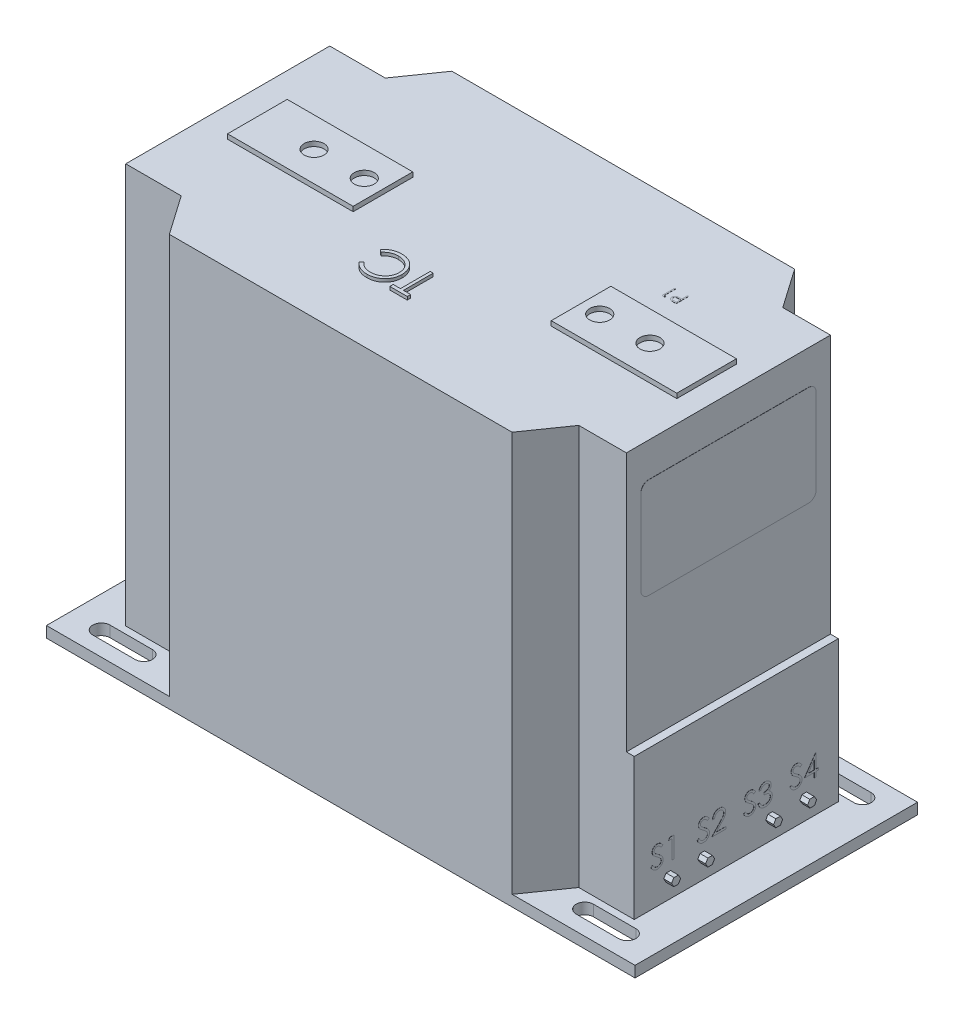
from build123d import *

# Parameters (mm, degrees)
CROQUIS1_W              = 375
CROQUIS1_H              = 180
SALIENTE_EXTRUIR1_DEPTH = 262
CROQUIS2_W              = 80
CROQUIS2_H              = 38
CROQUIS2_R              = 6.35
SALIENTE_EXTRUIR2_DEPTH = 3
CORTAR_EXTRUIR1_DEPTH   = 255
CORTAR_EXTRUIR2_DEPTH   = 277
CROQUIS5_W              = 130
CROQUIS5_H              = 165
CORTAR_EXTRUIR3_DEPTH   = 5
SALIENTE_EXTRUIR3_DEPTH = 5
SALIENTE_EXTRUIR4_DEPTH = 0.1
SALIENTE_EXTRUIR5_DEPTH = 0.1
CROQUIS9_R              = 4.75
SALIENTE_EXTRUIR6_DEPTH = 5
SALIENTE_EXTRUIR7_DEPTH = 0.1
SALIENTE_EXTRUIR8_DEPTH = 2


with BuildPart() as part:
    # Croquis1 → Saliente-Extruir1 (new body)
    with BuildSketch(Plane(origin=(0, 0, 0), x_dir=(1, 0, 0), z_dir=(0, 1, 0))):
        Rectangle(CROQUIS1_W, CROQUIS1_H)
    extrude(amount=SALIENTE_EXTRUIR1_DEPTH)

    # Croquis2 → Saliente-Extruir2 (add)
    # profile 1 of 2: a face of its own
    with BuildSketch(Plane(origin=(0, 262, 0), x_dir=(1, 0, 0), z_dir=(0, 1, 0))):
        with Locations((103.107795334, 0)):
            Rectangle(CROQUIS2_W, CROQUIS2_H)
        with Locations(Location((75, 0, 0), (0, 0, 270))):
            Circle(CROQUIS2_R, mode=Mode.SUBTRACT)
        with Locations(Location((107, 0, 0), (0, 0, 270))):
            Circle(CROQUIS2_R, mode=Mode.SUBTRACT)
    # profile 2 of 2: a face of its own
    with BuildSketch(Plane(origin=(0, 262, 0), x_dir=(1, 0, 0), z_dir=(0, 1, 0))):
        with Locations((-103.107795334, 0)):
            Rectangle(CROQUIS2_W, CROQUIS2_H)
        with Locations(Location((-107, 0, 0), (0, 0, 90))):
            Circle(CROQUIS2_R, mode=Mode.SUBTRACT)
        with Locations(Location((-75, 0, 0), (0, 0, 90))):
            Circle(CROQUIS2_R, mode=Mode.SUBTRACT)
    extrude(amount=SALIENTE_EXTRUIR2_DEPTH)

    # Croquis3 → Cortar-Extruir1 (cut)
    # profile 1 of 2: a face of its own
    with BuildSketch(Plane(origin=(0, 262, 0), x_dir=(1, 0, 0), z_dir=(0, 1, 0))):
        Polygon((-162, 65), (-126.646674595, 65), (-109.194539491, 90), (-187.5, 90), (-187.5, -90), (-109.194539491, -90), (-126.646674595, -65), (-162, -65), align=None)
        with BuildLine():
            ThreePointArc((-167.5, -80.5), (-173, -75), (-167.5, -69.5))
            Line((-167.5, -69.5), (-140.5, -69.5))
            ThreePointArc((-140.5, -69.5), (-135, -75), (-140.5, -80.5))
            Line((-140.5, -80.5), (-167.5, -80.5))
        make_face(mode=Mode.SUBTRACT)
        with BuildLine():
            Line((-140.5, 69.5), (-167.5, 69.5))
            ThreePointArc((-167.5, 69.5), (-173, 75), (-167.5, 80.5))
            Line((-167.5, 80.5), (-140.5, 80.5))
            ThreePointArc((-140.5, 80.5), (-135, 75), (-140.5, 69.5))
        make_face(mode=Mode.SUBTRACT)
    # profile 2 of 2: a face of its own
    with BuildSketch(Plane(origin=(0, 262, 0), x_dir=(1, 0, 0), z_dir=(0, 1, 0))):
        Polygon((187.5, 90), (109.194539491, 90), (126.646674595, 65), (162, 65), (162, -65), (126.646674595, -65), (109.194539491, -90), (187.5, -90), align=None)
        with BuildLine():
            Line((140.5, -69.5), (167.5, -69.5))
            ThreePointArc((167.5, -69.5), (173, -75), (167.5, -80.5))
            Line((167.5, -80.5), (140.5, -80.5))
            ThreePointArc((140.5, -80.5), (135, -75), (140.5, -69.5))
        make_face(mode=Mode.SUBTRACT)
        with BuildLine():
            ThreePointArc((167.5, 80.5), (173, 75), (167.5, 69.5))
            Line((167.5, 69.5), (140.5, 69.5))
            ThreePointArc((140.5, 69.5), (135, 75), (140.5, 80.5))
            Line((140.5, 80.5), (167.5, 80.5))
        make_face(mode=Mode.SUBTRACT)
    extrude(amount=-CORTAR_EXTRUIR1_DEPTH, mode=Mode.SUBTRACT)

    # Croquis4 → Cortar-Extruir2 (cut)
    with BuildSketch(Plane(origin=(0, 262, 0), x_dir=(1, 0, 0), z_dir=(0, 1, 0))):
        with BuildLine():
            Line((-167.5, 80.5), (-140.5, 80.5))
            ThreePointArc((-140.5, 80.5), (-135, 75), (-140.5, 69.5))
            Line((-140.5, 69.5), (-167.5, 69.5))
            ThreePointArc((-167.5, 69.5), (-173, 75), (-167.5, 80.5))
        make_face()
        with BuildLine():
            Line((-167.5, -69.5), (-140.5, -69.5))
            ThreePointArc((-140.5, -69.5), (-135, -75), (-140.5, -80.5))
            Line((-140.5, -80.5), (-167.5, -80.5))
            ThreePointArc((-167.5, -80.5), (-173, -75), (-167.5, -69.5))
        make_face()
        with BuildLine():
            Line((140.5, 80.5), (167.5, 80.5))
            ThreePointArc((167.5, 80.5), (173, 75), (167.5, 69.5))
            Line((167.5, 69.5), (140.5, 69.5))
            ThreePointArc((140.5, 69.5), (135, 75), (140.5, 80.5))
        make_face()
        with BuildLine():
            Line((140.5, -69.5), (167.5, -69.5))
            ThreePointArc((167.5, -69.5), (173, -75), (167.5, -80.5))
            Line((167.5, -80.5), (140.5, -80.5))
            ThreePointArc((140.5, -80.5), (135, -75), (140.5, -69.5))
        make_face()
    extrude(amount=-CORTAR_EXTRUIR2_DEPTH, mode=Mode.SUBTRACT)

    # Croquis5 → Cortar-Extruir3 (cut)
    with BuildSketch(Plane(origin=(162, 0, 0), x_dir=(0, 0, -1), z_dir=(1, 0, 0))):
        with Locations((0, 179.5)):
            Rectangle(CROQUIS5_W, CROQUIS5_H)
    extrude(amount=-CORTAR_EXTRUIR3_DEPTH, mode=Mode.SUBTRACT)

    # Croquis6 → Saliente-Extruir3 (add)
    with BuildSketch(Plane(origin=(162, 0, 0), x_dir=(0, 0, -1), z_dir=(1, 0, 0))):
        Polygon((24.553418013, 20), (23.11004234, 22.5), (20.223290994, 22.5), (18.779915321, 20), (20.223290994, 17.5), (23.11004234, 17.5), align=None)
        Polygon((44.857060225, 17.546077271), (46.222022868, 20.089738081), (44.701629309, 22.54366081), (41.816273108, 22.453922729), (40.451310465, 19.910261919), (41.971704024, 17.45633919), align=None)
        Polygon((-41.971704024, 17.45633919), (-44.857060225, 17.546077271), (-46.222022868, 20.089738081), (-44.701629309, 22.54366081), (-41.816273108, 22.453922729), (-40.451310465, 19.910261919), align=None)
        Polygon((-23.11004234, 17.5), (-24.553418013, 20), (-23.11004234, 22.5), (-20.223290994, 22.5), (-18.779915321, 20), (-20.223290994, 17.5), align=None)
    extrude(amount=SALIENTE_EXTRUIR3_DEPTH)

    # Croquis7 → Saliente-Extruir4 (add)
    # profile 1 of 8: a face of its own
    with BuildSketch(Plane(origin=(162, 0, 0), x_dir=(0, 0, -1), z_dir=(1, 0, 0))):
        with BuildLine():
            Line((-54.484508547, 30.4061874), (-53.366177551, 31.076655983))
            add(Edge.make_bspline(
                [(-53.366177551, 31.076655983), (-53.262165166, 30.902543576), (-53.06288145, 30.568950922), (-52.730446254, 30.118183924), (-52.385985548, 29.735059105), (-52.026948483, 29.421805261), (-51.655526596, 29.175180005), (-51.269295203, 29.00054657), (-50.869555859, 28.891629044), (-50.59751195, 28.87839955), (-50.461697049, 28.871794872)],
                knots=[0, 0, 0, 0, 1.272034388, 2.437168799, 3.508375237, 4.49857839, 5.41946034, 6.295179144, 7.148887113, 8, 8, 8, 8], degree=3))
            add(Edge.make_bspline(
                [(-50.461697049, 28.871794872), (-50.345708022, 28.87502533), (-50.115759505, 28.881429722), (-49.777235551, 28.942967278), (-49.448465048, 29.03750717), (-49.136224067, 29.172901762), (-48.844821, 29.336710919), (-48.589283788, 29.534567007), (-48.368371396, 29.756084511), (-48.187664326, 30.003215378), (-48.049022526, 30.268997457), (-47.94246322, 30.541805369), (-47.883328566, 30.825924659), (-47.8744206, 31.017220159), (-47.869925214, 31.113757011)],
                knots=[0, 0, 0, 0, 1.095163259, 2.171163733, 3.241058638, 4.321873601, 5.38011039, 6.391990106, 7.366004449, 8.327778327, 9.272591725, 10.192022065, 11.087607919, 12, 12, 12, 12], degree=3))
            add(Edge.make_bspline(
                [(-47.869925214, 31.113757011), (-47.875497757, 31.223902485), (-47.886825924, 31.447812137), (-47.982572887, 31.778162016), (-48.133193552, 32.105083337), (-48.272147592, 32.307305383), (-48.344288361, 32.412293002)],
                knots=[0, 0, 0, 0, 0.938893495, 1.908633276, 2.914225137, 4, 4, 4, 4], degree=3))
            add(Edge.make_bspline(
                [(-48.344288361, 32.412293002), (-48.403519552, 32.488065222), (-48.527868027, 32.64713952), (-48.741641959, 32.883923595), (-48.992490069, 33.128165833), (-49.271827911, 33.389192626), (-49.589830955, 33.654863762), (-49.93653912, 33.937848027), (-50.320804301, 34.22738375), (-50.590299422, 34.421559816), (-50.729354467, 34.521751469)],
                knots=[0, 0, 0, 0, 0.722233717, 1.516239348, 2.393582979, 3.351407094, 4.387010283, 5.505090956, 6.712668013, 8, 8, 8, 8], degree=3))
            add(Edge.make_bspline(
                [(-50.729354467, 34.521751469), (-50.868540405, 34.620889285), (-51.13465332, 34.810433241), (-51.506803318, 35.091739314), (-51.839590426, 35.34892894), (-52.131535518, 35.584423272), (-52.382510184, 35.798254248), (-52.594492125, 35.988368482), (-52.762081314, 36.159907537), (-52.855273538, 36.271188799), (-52.89711455, 36.321151342)],
                knots=[0, 0, 0, 0, 1.452282411, 2.77665338, 3.964542531, 5.026858415, 5.96415736, 6.766646006, 7.446254459, 8, 8, 8, 8], degree=3))
            add(Edge.make_bspline(
                [(-52.89711455, 36.321151342), (-52.955597087, 36.399018356), (-53.070610845, 36.55215429), (-53.222428782, 36.791507175), (-53.351466689, 37.036523684), (-53.452621933, 37.28786222), (-53.537803474, 37.541994243), (-53.595096843, 37.802235559), (-53.630972064, 38.067418432), (-53.634645941, 38.245874223), (-53.636485043, 38.335207165)],
                knots=[0, 0, 0, 0, 1.068054152, 2.10047183, 3.106115577, 4.101338837, 5.06977816, 6.043150881, 7.020423561, 8, 8, 8, 8], degree=3))
            add(Edge.make_bspline(
                [(-53.636485043, 38.335207165), (-53.631551664, 38.475170896), (-53.621790353, 38.752106732), (-53.539238397, 39.156657788), (-53.408939067, 39.542898115), (-53.22639589, 39.90700384), (-52.991077919, 40.239494304), (-52.71876129, 40.544194091), (-52.394414303, 40.800343196), (-52.038539804, 41.024150679), (-51.649011255, 41.199327242), (-51.240831352, 41.331471422), (-50.813351348, 41.4063457), (-50.523809738, 41.417090675), (-50.376894698, 41.422542735)],
                knots=[0, 0, 0, 0, 1.005424448, 1.989358655, 2.955360095, 3.929531133, 4.905563448, 5.876582895, 6.856512386, 7.866279853, 8.892233794, 9.918561126, 10.94386622, 12, 12, 12, 12], degree=3))
            add(Edge.make_bspline(
                [(-50.376894698, 41.422542735), (-50.221001819, 41.417165829), (-49.910980638, 41.406472878), (-49.45495533, 41.313500066), (-49.015895479, 41.159661218), (-48.662702186, 40.985079088), (-48.38627776, 40.81071332), (-48.17547011, 40.651888389), (-47.961847603, 40.469041996), (-47.743687098, 40.261687108), (-47.524685201, 40.027921114), (-47.301590604, 39.769344998), (-47.073881612, 39.487538969), (-46.927393688, 39.286363028), (-46.852297009, 39.183230669)],
                knots=[0, 0, 0, 0, 1.286793592, 2.559021753, 3.825965368, 5.121522368, 5.803751409, 6.523245864, 7.299691795, 8.125521123, 9.008227632, 9.944561021, 10.946284179, 12, 12, 12, 12], degree=3))
            Line((-46.852297009, 39.183230669), (-47.925576756, 38.36965812))
            add(Edge.make_bspline(
                [(-47.925576756, 38.36965812), (-47.990384299, 38.45314811), (-48.115188473, 38.613930311), (-48.304665997, 38.839095701), (-48.483254637, 39.044777037), (-48.659204065, 39.223427967), (-48.82322166, 39.384831864), (-48.982414051, 39.52301904), (-49.13449032, 39.639343464), (-49.326188166, 39.7634843), (-49.567025971, 39.886540132), (-49.869348474, 39.990669088), (-50.185284692, 40.05324328), (-50.400465144, 40.061516754), (-50.509398371, 40.065705128)],
                knots=[0, 0, 0, 0, 1.181633172, 2.275549214, 3.290209073, 4.226197932, 5.078386478, 5.862611352, 6.581680152, 7.217281963, 8.414376989, 9.595101626, 10.782541182, 12, 12, 12, 12], degree=3))
            add(Edge.make_bspline(
                [(-50.509398371, 40.065705128), (-50.646061417, 40.061125191), (-50.909603227, 40.052293213), (-51.28376275, 39.955833745), (-51.620516574, 39.80395588), (-51.909867043, 39.591098671), (-52.150777641, 39.338909205), (-52.325045298, 39.048703413), (-52.429934313, 38.728246118), (-52.442733643, 38.504704738), (-52.449252137, 38.390858707)],
                knots=[0, 0, 0, 0, 1.14458467, 2.207223713, 3.21896685, 4.227309161, 5.202851033, 6.127160689, 7.046193047, 8, 8, 8, 8], degree=3))
            add(Edge.make_bspline(
                [(-52.449252137, 38.390858707), (-52.447766212, 38.319982583), (-52.444791932, 38.178114438), (-52.40330981, 37.968521266), (-52.350017703, 37.759457572), (-52.265567875, 37.551863286), (-52.148979971, 37.342107822), (-51.99588005, 37.12657923), (-51.803061877, 36.903377831), (-51.655360074, 36.758207103), (-51.577377971, 36.681561331)],
                knots=[0, 0, 0, 0, 0.858281714, 1.717966888, 2.583508476, 3.4729293, 4.427298488, 5.488583878, 6.674047936, 8, 8, 8, 8], degree=3))
            add(Edge.make_bspline(
                [(-51.577377971, 36.681561331), (-51.548419808, 36.655719002), (-51.47962184, 36.594323542), (-51.353846763, 36.493811052), (-51.187753449, 36.369824383), (-50.985679057, 36.216413991), (-50.74389766, 36.038457274), (-50.462382671, 35.838229632), (-50.144272116, 35.609231023), (-49.918537493, 35.449129604), (-49.799178686, 35.364474826)],
                knots=[0, 0, 0, 0, 0.420754252, 0.999615792, 1.744751191, 2.668019286, 3.750313428, 4.999500688, 6.413464383, 8, 8, 8, 8], degree=3))
            add(Edge.make_bspline(
                [(-49.799178686, 35.364474826), (-49.655600978, 35.259997069), (-49.377582646, 35.057690371), (-48.982001912, 34.753738247), (-48.623325911, 34.456468407), (-48.30029535, 34.167779238), (-48.00971894, 33.889860553), (-47.754820413, 33.61936877), (-47.533002514, 33.358241754), (-47.294200111, 33.023458507), (-47.050186924, 32.612291909), (-46.840631226, 32.1085319), (-46.708496996, 31.602813665), (-46.691217756, 31.262911634), (-46.682692308, 31.095206497)],
                knots=[0, 0, 0, 0, 1.163667725, 2.253281268, 3.268753668, 4.215851969, 5.092017293, 5.902905408, 6.650798638, 7.335211899, 8.59617414, 9.77448103, 10.901945474, 12, 12, 12, 12], degree=3))
            add(Edge.make_bspline(
                [(-46.682692308, 31.095206497), (-46.685176133, 30.976603748), (-46.69009555, 30.741701435), (-46.746644242, 30.396778972), (-46.829495358, 30.061775387), (-46.954368236, 29.740831599), (-47.106780174, 29.428076097), (-47.300176408, 29.131712902), (-47.524345335, 28.845182765), (-47.781496768, 28.576126116), (-48.062884554, 28.329133054), (-48.360290185, 28.109419042), (-48.674200443, 27.926220319), (-49.002912414, 27.776727553), (-49.346501603, 27.659806222), (-49.704852453, 27.575090913), (-50.078555665, 27.523097601), (-50.332557485, 27.517701003), (-50.461697049, 27.514957265)],
                knots=[0, 0, 0, 0, 0.983748083, 1.948392443, 2.894712957, 3.844097841, 4.80183111, 5.778335162, 6.776009319, 7.81870978, 8.863265674, 9.881300176, 10.883814829, 11.87499822, 12.874611388, 13.892143829, 14.928324115, 16, 16, 16, 16], degree=3))
            add(Edge.make_bspline(
                [(-50.461697049, 27.514957265), (-50.561616351, 27.51688941), (-50.760196575, 27.520729366), (-51.053919914, 27.554676467), (-51.341709433, 27.602706293), (-51.619953892, 27.678959475), (-51.892238156, 27.77147662), (-52.157378001, 27.885392341), (-52.415501925, 28.021906764), (-52.668056479, 28.177992124), (-52.914399341, 28.359638957), (-53.152219949, 28.571205446), (-53.389321335, 28.806856611), (-53.618705244, 29.072991776), (-53.845011474, 29.365311315), (-54.063778081, 29.686550193), (-54.279533383, 30.034958643), (-54.414907324, 30.280133223), (-54.484508547, 30.4061874)],
                knots=[0, 0, 0, 0, 0.915332311, 1.819136955, 2.706846663, 3.586547465, 4.459518054, 5.340707479, 6.227863349, 7.133153174, 8.059268498, 9.028702269, 10.047606654, 11.120612155, 12.245963614, 13.433783089, 14.680604001, 16, 16, 16, 16], degree=3))
        make_face()
    # profile 2 of 8: a face of its own
    with BuildSketch(Plane(origin=(162, 0, 0), x_dir=(0, 0, -1), z_dir=(1, 0, 0))):
        Polygon((-42.344522069, 41.083333333), (-39.898504274, 41.083333333), (-39.898504274, 27.854166667), (-41.085737179, 27.854166667), (-41.085737179, 39.726495726), (-43.12099359, 39.726495726), align=None)
    # profile 3 of 8: a face of its own
    with BuildSketch(Plane(origin=(162, 0, 0), x_dir=(0, 0, -1), z_dir=(1, 0, 0))):
        with BuildLine():
            Line((-24.973290598, 30.4061874), (-23.854959602, 31.076655983))
            add(Edge.make_bspline(
                [(-23.854959602, 31.076655983), (-23.750947217, 30.902543576), (-23.551663502, 30.568950922), (-23.219228305, 30.118183924), (-22.874767599, 29.735059105), (-22.515730535, 29.421805261), (-22.144308647, 29.175180005), (-21.758077254, 29.00054657), (-21.35833791, 28.891629044), (-21.086294001, 28.87839955), (-20.9504791, 28.871794872)],
                knots=[0, 0, 0, 0, 1.272034388, 2.437168799, 3.508375237, 4.49857839, 5.41946034, 6.295179144, 7.148887113, 8, 8, 8, 8], degree=3))
            add(Edge.make_bspline(
                [(-20.9504791, 28.871794872), (-20.834490074, 28.87502533), (-20.604541556, 28.881429722), (-20.266017602, 28.942967278), (-19.9372471, 29.03750717), (-19.625006118, 29.172901762), (-19.333603051, 29.336710919), (-19.078065839, 29.534567007), (-18.857153447, 29.756084511), (-18.676446377, 30.003215378), (-18.537804577, 30.268997457), (-18.431245271, 30.541805369), (-18.372110618, 30.825924659), (-18.363202651, 31.017220159), (-18.358707265, 31.113757011)],
                knots=[0, 0, 0, 0, 1.095163259, 2.171163733, 3.241058638, 4.321873601, 5.38011039, 6.391990106, 7.366004449, 8.327778327, 9.272591725, 10.192022065, 11.087607919, 12, 12, 12, 12], degree=3))
            add(Edge.make_bspline(
                [(-18.358707265, 31.113757011), (-18.364279808, 31.223902485), (-18.375607975, 31.447812137), (-18.471354938, 31.778162016), (-18.621975603, 32.105083337), (-18.760929644, 32.307305383), (-18.833070413, 32.412293002)],
                knots=[0, 0, 0, 0, 0.938893495, 1.908633276, 2.914225137, 4, 4, 4, 4], degree=3))
            add(Edge.make_bspline(
                [(-18.833070413, 32.412293002), (-18.892301603, 32.488065222), (-19.016650079, 32.64713952), (-19.23042401, 32.883923595), (-19.481272121, 33.128165833), (-19.760609962, 33.389192626), (-20.078613006, 33.654863762), (-20.425321171, 33.937848027), (-20.809586352, 34.22738375), (-21.079081473, 34.421559816), (-21.218136518, 34.521751469)],
                knots=[0, 0, 0, 0, 0.722233717, 1.516239348, 2.393582979, 3.351407094, 4.387010283, 5.505090956, 6.712668013, 8, 8, 8, 8], degree=3))
            add(Edge.make_bspline(
                [(-21.218136518, 34.521751469), (-21.357322456, 34.620889285), (-21.623435371, 34.810433241), (-21.99558537, 35.091739314), (-22.328372477, 35.34892894), (-22.620317569, 35.584423272), (-22.871292236, 35.798254248), (-23.083274176, 35.988368482), (-23.250863365, 36.159907537), (-23.34405559, 36.271188799), (-23.385896601, 36.321151342)],
                knots=[0, 0, 0, 0, 1.452282411, 2.77665338, 3.964542531, 5.026858415, 5.96415736, 6.766646006, 7.446254459, 8, 8, 8, 8], degree=3))
            add(Edge.make_bspline(
                [(-23.385896601, 36.321151342), (-23.444379138, 36.399018356), (-23.559392896, 36.55215429), (-23.711210833, 36.791507175), (-23.84024874, 37.036523684), (-23.941403984, 37.28786222), (-24.026585525, 37.541994243), (-24.083878894, 37.802235559), (-24.119754115, 38.067418432), (-24.123427993, 38.245874223), (-24.125267094, 38.335207165)],
                knots=[0, 0, 0, 0, 1.068054152, 2.10047183, 3.106115577, 4.101338837, 5.06977816, 6.043150881, 7.020423561, 8, 8, 8, 8], degree=3))
            add(Edge.make_bspline(
                [(-24.125267094, 38.335207165), (-24.120333715, 38.475170896), (-24.110572404, 38.752106732), (-24.028020449, 39.156657788), (-23.897721118, 39.542898115), (-23.715177941, 39.90700384), (-23.47985997, 40.239494304), (-23.207543341, 40.544194091), (-22.883196354, 40.800343196), (-22.527321856, 41.024150679), (-22.137793306, 41.199327242), (-21.729613404, 41.331471422), (-21.302133399, 41.4063457), (-21.012591789, 41.417090675), (-20.865676749, 41.422542735)],
                knots=[0, 0, 0, 0, 1.005424448, 1.989358655, 2.955360095, 3.929531133, 4.905563448, 5.876582895, 6.856512386, 7.866279853, 8.892233794, 9.918561126, 10.94386622, 12, 12, 12, 12], degree=3))
            add(Edge.make_bspline(
                [(-20.865676749, 41.422542735), (-20.70978387, 41.417165829), (-20.39976269, 41.406472878), (-19.943737381, 41.313500066), (-19.50467753, 41.159661218), (-19.151484238, 40.985079088), (-18.875059812, 40.81071332), (-18.664252161, 40.651888389), (-18.450629654, 40.469041996), (-18.232469149, 40.261687108), (-18.013467252, 40.027921114), (-17.790372656, 39.769344998), (-17.562663663, 39.487538969), (-17.41617574, 39.286363028), (-17.34107906, 39.183230669)],
                knots=[0, 0, 0, 0, 1.286793592, 2.559021753, 3.825965368, 5.121522368, 5.803751409, 6.523245864, 7.299691795, 8.125521123, 9.008227632, 9.944561021, 10.946284179, 12, 12, 12, 12], degree=3))
            Line((-17.34107906, 39.183230669), (-18.414358807, 38.36965812))
            add(Edge.make_bspline(
                [(-18.414358807, 38.36965812), (-18.47916635, 38.45314811), (-18.603970524, 38.613930311), (-18.793448049, 38.839095701), (-18.972036688, 39.044777037), (-19.147986116, 39.223427967), (-19.312003711, 39.384831864), (-19.471196103, 39.52301904), (-19.623272371, 39.639343464), (-19.814970218, 39.7634843), (-20.055808022, 39.886540132), (-20.358130525, 39.990669088), (-20.674066743, 40.05324328), (-20.889247196, 40.061516754), (-20.998180422, 40.065705128)],
                knots=[0, 0, 0, 0, 1.181633172, 2.275549214, 3.290209073, 4.226197932, 5.078386478, 5.862611352, 6.581680152, 7.217281963, 8.414376989, 9.595101626, 10.782541182, 12, 12, 12, 12], degree=3))
            add(Edge.make_bspline(
                [(-20.998180422, 40.065705128), (-21.134843468, 40.061125191), (-21.398385278, 40.052293213), (-21.772544802, 39.955833745), (-22.109298625, 39.80395588), (-22.398649095, 39.591098671), (-22.639559692, 39.338909205), (-22.813827349, 39.048703413), (-22.918716364, 38.728246118), (-22.931515695, 38.504704738), (-22.938034188, 38.390858707)],
                knots=[0, 0, 0, 0, 1.14458467, 2.207223713, 3.21896685, 4.227309161, 5.202851033, 6.127160689, 7.046193047, 8, 8, 8, 8], degree=3))
            add(Edge.make_bspline(
                [(-22.938034188, 38.390858707), (-22.936548263, 38.319982583), (-22.933573983, 38.178114438), (-22.892091861, 37.968521266), (-22.838799754, 37.759457572), (-22.754349926, 37.551863286), (-22.637762022, 37.342107822), (-22.484662102, 37.12657923), (-22.291843928, 36.903377831), (-22.144142125, 36.758207103), (-22.066160023, 36.681561331)],
                knots=[0, 0, 0, 0, 0.858281714, 1.717966888, 2.583508476, 3.4729293, 4.427298488, 5.488583878, 6.674047936, 8, 8, 8, 8], degree=3))
            add(Edge.make_bspline(
                [(-22.066160023, 36.681561331), (-22.037201859, 36.655719002), (-21.968403891, 36.594323542), (-21.842628815, 36.493811052), (-21.6765355, 36.369824383), (-21.474461109, 36.216413991), (-21.232679712, 36.038457274), (-20.951164723, 35.838229632), (-20.633054167, 35.609231023), (-20.407319544, 35.449129604), (-20.287960737, 35.364474826)],
                knots=[0, 0, 0, 0, 0.420754252, 0.999615792, 1.744751191, 2.668019286, 3.750313428, 4.999500688, 6.413464383, 8, 8, 8, 8], degree=3))
            add(Edge.make_bspline(
                [(-20.287960737, 35.364474826), (-20.144383029, 35.259997069), (-19.866364697, 35.057690371), (-19.470783963, 34.753738247), (-19.112107963, 34.456468407), (-18.789077401, 34.167779238), (-18.498500992, 33.889860553), (-18.243602464, 33.61936877), (-18.021784565, 33.358241754), (-17.782982162, 33.023458507), (-17.538968975, 32.612291909), (-17.329413277, 32.1085319), (-17.197279047, 31.602813665), (-17.179999808, 31.262911634), (-17.171474359, 31.095206497)],
                knots=[0, 0, 0, 0, 1.163667725, 2.253281268, 3.268753668, 4.215851969, 5.092017293, 5.902905408, 6.650798638, 7.335211899, 8.59617414, 9.77448103, 10.901945474, 12, 12, 12, 12], degree=3))
            add(Edge.make_bspline(
                [(-17.171474359, 31.095206497), (-17.173958185, 30.976603748), (-17.178877602, 30.741701435), (-17.235426294, 30.396778972), (-17.318277409, 30.061775387), (-17.443150287, 29.740831599), (-17.595562225, 29.428076097), (-17.788958459, 29.131712902), (-18.013127387, 28.845182765), (-18.27027882, 28.576126116), (-18.551666605, 28.329133054), (-18.849072237, 28.109419042), (-19.162982495, 27.926220319), (-19.491694465, 27.776727553), (-19.835283655, 27.659806222), (-20.193634504, 27.575090913), (-20.567337716, 27.523097601), (-20.821339537, 27.517701003), (-20.9504791, 27.514957265)],
                knots=[0, 0, 0, 0, 0.983748083, 1.948392443, 2.894712957, 3.844097841, 4.80183111, 5.778335162, 6.776009319, 7.81870978, 8.863265674, 9.881300176, 10.883814829, 11.87499822, 12.874611388, 13.892143829, 14.928324115, 16, 16, 16, 16], degree=3))
            add(Edge.make_bspline(
                [(-20.9504791, 27.514957265), (-21.050398402, 27.51688941), (-21.248978626, 27.520729366), (-21.542701965, 27.554676467), (-21.830491484, 27.602706293), (-22.108735943, 27.678959475), (-22.381020207, 27.77147662), (-22.646160052, 27.885392341), (-22.904283976, 28.021906764), (-23.15683853, 28.177992124), (-23.403181392, 28.359638957), (-23.641002, 28.571205446), (-23.878103386, 28.806856611), (-24.107487295, 29.072991776), (-24.333793525, 29.365311315), (-24.552560132, 29.686550193), (-24.768315434, 30.034958643), (-24.903689375, 30.280133223), (-24.973290598, 30.4061874)],
                knots=[0, 0, 0, 0, 0.915332311, 1.819136955, 2.706846663, 3.586547465, 4.459518054, 5.340707479, 6.227863349, 7.133153174, 8.059268498, 9.028702269, 10.047606654, 11.120612155, 12.245963614, 13.433783089, 14.680604001, 16, 16, 16, 16], degree=3))
        make_face()
    # profile 4 of 8: a face of its own
    with BuildSketch(Plane(origin=(162, 0, 0), x_dir=(0, 0, -1), z_dir=(1, 0, 0))):
        with BuildLine():
            Line((-13.948985043, 37.012820513), (-15.136217949, 37.012820513))
            add(Edge.make_bspline(
                [(-15.136217949, 37.012820513), (-15.128480198, 37.170326547), (-15.113283461, 37.479664206), (-15.04211701, 37.930680162), (-14.940286909, 38.361780145), (-14.796310282, 38.769502737), (-14.617503816, 39.15745299), (-14.403077819, 39.524089954), (-14.149101063, 39.868014983), (-13.861057753, 40.186039778), (-13.548212004, 40.477790417), (-13.210656816, 40.729731365), (-12.855944957, 40.942598754), (-12.485152586, 41.120554638), (-12.094096289, 41.254130841), (-11.686324773, 41.353242396), (-11.260046489, 41.412873226), (-10.969609501, 41.419282892), (-10.821898371, 41.422542735)],
                knots=[0, 0, 0, 0, 1.10065271, 2.161652631, 3.183658789, 4.190468796, 5.17591951, 6.163126047, 7.15150782, 8.156236427, 9.156009102, 10.134482811, 11.092018607, 12.041330605, 13.001268258, 13.972401359, 14.968799086, 16, 16, 16, 16], degree=3))
            add(Edge.make_bspline(
                [(-10.821898371, 41.422542735), (-10.676838388, 41.419146784), (-10.391800705, 41.41247386), (-9.975792495, 41.355168779), (-9.579759269, 41.265416097), (-9.204475152, 41.139491755), (-8.852934372, 40.970217283), (-8.522496078, 40.766875396), (-8.209226347, 40.531699247), (-7.927230469, 40.254817274), (-7.668286241, 39.95923088), (-7.444893788, 39.643666483), (-7.253588081, 39.317740313), (-7.094128696, 38.978967051), (-6.976743885, 38.624156914), (-6.887623872, 38.258475523), (-6.837249422, 37.878137695), (-6.829518208, 37.620711131), (-6.825587607, 37.489833734)],
                knots=[0, 0, 0, 0, 1.111607364, 2.184268762, 3.212621178, 4.221274766, 5.211760367, 6.196651075, 7.1921475, 8.207485113, 9.220403448, 10.201281604, 11.166441695, 12.114753415, 13.065576456, 14.026450734, 14.996634279, 16, 16, 16, 16], degree=3))
            add(Edge.make_bspline(
                [(-6.825587607, 37.489833734), (-6.831987737, 37.305578526), (-6.844675685, 36.940301528), (-6.953209192, 36.40351916), (-7.122718326, 35.883448796), (-7.326815478, 35.46488816), (-7.532708347, 35.1276068), (-7.718247438, 34.849912588), (-7.935450742, 34.550912752), (-8.187479588, 34.23160853), (-8.469120504, 33.889498859), (-8.782924514, 33.524790406), (-9.131129342, 33.141251276), (-9.37552308, 32.879292604), (-9.502161792, 32.743552183)],
                knots=[0, 0, 0, 0, 1.184426356, 2.348067706, 3.509069118, 4.696110526, 5.333549288, 6.050745305, 6.844228056, 7.710549037, 8.667450064, 9.695053472, 10.805634456, 12, 12, 12, 12], degree=3))
            Line((-9.502161792, 32.743552183), (-12.812103532, 29.211004274))
            Line((-12.812103532, 29.211004274), (-6.655982906, 29.211004274))
            Line((-6.655982906, 29.211004274), (-6.655982906, 27.854166667))
            Line((-6.655982906, 27.854166667), (-15.645032051, 27.854166667))
            Line((-15.645032051, 27.854166667), (-10.51448985, 33.329218416))
            add(Edge.make_bspline(
                [(-10.51448985, 33.329218416), (-10.389576707, 33.459613801), (-10.149644122, 33.710076649), (-9.810287359, 34.075742004), (-9.505491183, 34.4149739), (-9.233282585, 34.727131389), (-8.999566657, 35.01678047), (-8.792162685, 35.274540213), (-8.625983219, 35.511737093), (-8.445630384, 35.786679295), (-8.270952538, 36.122368708), (-8.120849287, 36.532600212), (-8.029322926, 36.954902625), (-8.018343339, 37.240282349), (-8.012820513, 37.383830796)],
                knots=[0, 0, 0, 0, 1.329631726, 2.553950428, 3.673215718, 4.687767853, 5.603093632, 6.413772471, 7.123043292, 7.734684054, 8.834405432, 9.900288307, 10.943827018, 12, 12, 12, 12], degree=3))
            add(Edge.make_bspline(
                [(-8.012820513, 37.383830796), (-8.015223467, 37.474096796), (-8.019959229, 37.651993748), (-8.061754693, 37.912819087), (-8.124916427, 38.164418235), (-8.215423802, 38.407565099), (-8.334889754, 38.639815034), (-8.480309969, 38.861450747), (-8.64809384, 39.075721539), (-8.842189412, 39.27662835), (-9.055411525, 39.460631716), (-9.2806636, 39.623630491), (-9.518977982, 39.759849749), (-9.769349872, 39.871517134), (-10.031081259, 39.959114557), (-10.304678362, 40.019812164), (-10.589385209, 40.057921553), (-10.783791576, 40.063077798), (-10.88285006, 40.065705128)],
                knots=[0, 0, 0, 0, 0.991446411, 1.95395049, 2.89581595, 3.838931463, 4.798493298, 5.75982156, 6.748411868, 7.785213223, 8.824556874, 9.840280684, 10.836137867, 11.835679398, 12.848801643, 13.863922112, 14.911575587, 16, 16, 16, 16], degree=3))
            add(Edge.make_bspline(
                [(-10.88285006, 40.065705128), (-10.986305291, 40.063002476), (-11.189474283, 40.057694915), (-11.487769437, 40.020567584), (-11.772331751, 39.956516342), (-12.043877039, 39.868914031), (-12.302864759, 39.75756773), (-12.548035402, 39.618881671), (-12.778838584, 39.453390492), (-12.995708181, 39.265761008), (-13.195521436, 39.056862635), (-13.371079568, 38.823991643), (-13.524477478, 38.571399924), (-13.65831595, 38.299769034), (-13.767005612, 38.006634211), (-13.850058889, 37.693036041), (-13.91577703, 37.360336176), (-13.937731855, 37.130583028), (-13.948985043, 37.012820513)],
                knots=[0, 0, 0, 0, 1.031018746, 2.02475058, 2.990194455, 3.934040569, 4.864654155, 5.795059489, 6.735614925, 7.690564532, 8.649604399, 9.611025574, 10.590972636, 11.591080095, 12.624614302, 13.701020113, 14.821632451, 16, 16, 16, 16], degree=3))
        make_face()
    # profile 5 of 8: a face of its own
    with BuildSketch(Plane(origin=(162, 0, 0), x_dir=(0, 0, -1), z_dir=(1, 0, 0))):
        with BuildLine():
            Line((4.53792735, 30.4061874), (5.656258347, 31.076655983))
            add(Edge.make_bspline(
                [(5.656258347, 31.076655983), (5.760270732, 30.902543576), (5.959554447, 30.568950922), (6.291989644, 30.118183924), (6.63645035, 29.735059105), (6.995487414, 29.421805261), (7.366909301, 29.175180005), (7.753140695, 29.00054657), (8.152880039, 28.891629044), (8.424923947, 28.87839955), (8.560738849, 28.871794872)],
                knots=[0, 0, 0, 0, 1.272034388, 2.437168799, 3.508375237, 4.49857839, 5.41946034, 6.295179144, 7.148887113, 8, 8, 8, 8], degree=3))
            add(Edge.make_bspline(
                [(8.560738849, 28.871794872), (8.676727875, 28.87502533), (8.906676392, 28.881429722), (9.245200346, 28.942967278), (9.573970849, 29.03750717), (9.886211831, 29.172901762), (10.177614898, 29.336710919), (10.433152109, 29.534567007), (10.654064501, 29.756084511), (10.834771571, 30.003215378), (10.973413371, 30.268997457), (11.079972678, 30.541805369), (11.139107331, 30.825924659), (11.148015298, 31.017220159), (11.152510684, 31.113757011)],
                knots=[0, 0, 0, 0, 1.095163259, 2.171163733, 3.241058638, 4.321873601, 5.38011039, 6.391990106, 7.366004449, 8.327778327, 9.272591725, 10.192022065, 11.087607919, 12, 12, 12, 12], degree=3))
            add(Edge.make_bspline(
                [(11.152510684, 31.113757011), (11.14693814, 31.223902485), (11.135609974, 31.447812137), (11.039863011, 31.778162016), (10.889242345, 32.105083337), (10.750288305, 32.307305383), (10.678147536, 32.412293002)],
                knots=[0, 0, 0, 0, 0.938893495, 1.908633276, 2.914225137, 4, 4, 4, 4], degree=3))
            add(Edge.make_bspline(
                [(10.678147536, 32.412293002), (10.618916346, 32.488065222), (10.49456787, 32.64713952), (10.280793939, 32.883923595), (10.029945828, 33.128165833), (9.750607986, 33.389192626), (9.432604942, 33.654863762), (9.085896778, 33.937848027), (8.701631597, 34.22738375), (8.432136475, 34.421559816), (8.29308143, 34.521751469)],
                knots=[0, 0, 0, 0, 0.722233717, 1.516239348, 2.393582979, 3.351407094, 4.387010283, 5.505090956, 6.712668013, 8, 8, 8, 8], degree=3))
            add(Edge.make_bspline(
                [(8.29308143, 34.521751469), (8.153895492, 34.620889285), (7.887782578, 34.810433241), (7.515632579, 35.091739314), (7.182845472, 35.34892894), (6.89090038, 35.584423272), (6.639925713, 35.798254248), (6.427943773, 35.988368482), (6.260354584, 36.159907537), (6.167162359, 36.271188799), (6.125321347, 36.321151342)],
                knots=[0, 0, 0, 0, 1.452282411, 2.77665338, 3.964542531, 5.026858415, 5.96415736, 6.766646006, 7.446254459, 8, 8, 8, 8], degree=3))
            add(Edge.make_bspline(
                [(6.125321347, 36.321151342), (6.06683881, 36.399018356), (5.951825053, 36.55215429), (5.800007115, 36.791507175), (5.670969208, 37.036523684), (5.569813965, 37.28786222), (5.484632423, 37.541994243), (5.427339054, 37.802235559), (5.391463834, 38.067418432), (5.387789956, 38.245874223), (5.385950855, 38.335207165)],
                knots=[0, 0, 0, 0, 1.068054152, 2.10047183, 3.106115577, 4.101338837, 5.06977816, 6.043150881, 7.020423561, 8, 8, 8, 8], degree=3))
            add(Edge.make_bspline(
                [(5.385950855, 38.335207165), (5.390884234, 38.475170896), (5.400645545, 38.752106732), (5.4831975, 39.156657788), (5.61349683, 39.542898115), (5.796040008, 39.90700384), (6.031357978, 40.239494304), (6.303674608, 40.544194091), (6.628021594, 40.800343196), (6.983896093, 41.024150679), (7.373424642, 41.199327242), (7.781604545, 41.331471422), (8.209084549, 41.4063457), (8.498626159, 41.417090675), (8.645541199, 41.422542735)],
                knots=[0, 0, 0, 0, 1.005424448, 1.989358655, 2.955360095, 3.929531133, 4.905563448, 5.876582895, 6.856512386, 7.866279853, 8.892233794, 9.918561126, 10.94386622, 12, 12, 12, 12], degree=3))
            add(Edge.make_bspline(
                [(8.645541199, 41.422542735), (8.801434078, 41.417165829), (9.111455259, 41.406472878), (9.567480568, 41.313500066), (10.006540419, 41.159661218), (10.359733711, 40.985079088), (10.636158137, 40.81071332), (10.846965787, 40.651888389), (11.060588295, 40.469041996), (11.2787488, 40.261687108), (11.497750697, 40.027921114), (11.720845293, 39.769344998), (11.948554285, 39.487538969), (12.095042209, 39.286363028), (12.170138889, 39.183230669)],
                knots=[0, 0, 0, 0, 1.286793592, 2.559021753, 3.825965368, 5.121522368, 5.803751409, 6.523245864, 7.299691795, 8.125521123, 9.008227632, 9.944561021, 10.946284179, 12, 12, 12, 12], degree=3))
            Line((12.170138889, 39.183230669), (11.096859141, 38.36965812))
            add(Edge.make_bspline(
                [(11.096859141, 38.36965812), (11.032051599, 38.45314811), (10.907247425, 38.613930311), (10.7177699, 38.839095701), (10.539181261, 39.044777037), (10.363231833, 39.223427967), (10.199214238, 39.384831864), (10.040021846, 39.52301904), (9.887945578, 39.639343464), (9.696247731, 39.7634843), (9.455409927, 39.886540132), (9.153087424, 39.990669088), (8.837151206, 40.05324328), (8.621970753, 40.061516754), (8.513037527, 40.065705128)],
                knots=[0, 0, 0, 0, 1.181633172, 2.275549214, 3.290209073, 4.226197932, 5.078386478, 5.862611352, 6.581680152, 7.217281963, 8.414376989, 9.595101626, 10.782541182, 12, 12, 12, 12], degree=3))
            add(Edge.make_bspline(
                [(8.513037527, 40.065705128), (8.376374481, 40.061125191), (8.112832671, 40.052293213), (7.738673147, 39.955833745), (7.401919323, 39.80395588), (7.112568854, 39.591098671), (6.871658256, 39.338909205), (6.6973906, 39.048703413), (6.592501585, 38.728246118), (6.579702254, 38.504704738), (6.573183761, 38.390858707)],
                knots=[0, 0, 0, 0, 1.14458467, 2.207223713, 3.21896685, 4.227309161, 5.202851033, 6.127160689, 7.046193047, 8, 8, 8, 8], degree=3))
            add(Edge.make_bspline(
                [(6.573183761, 38.390858707), (6.574669686, 38.319982583), (6.577643966, 38.178114438), (6.619126088, 37.968521266), (6.672418194, 37.759457572), (6.756868023, 37.551863286), (6.873455926, 37.342107822), (7.026555847, 37.12657923), (7.219374021, 36.903377831), (7.367075823, 36.758207103), (7.445057926, 36.681561331)],
                knots=[0, 0, 0, 0, 0.858281714, 1.717966888, 2.583508476, 3.4729293, 4.427298488, 5.488583878, 6.674047936, 8, 8, 8, 8], degree=3))
            add(Edge.make_bspline(
                [(7.445057926, 36.681561331), (7.47401609, 36.655719002), (7.542814058, 36.594323542), (7.668589134, 36.493811052), (7.834682449, 36.369824383), (8.03675684, 36.216413991), (8.278538237, 36.038457274), (8.560053226, 35.838229632), (8.878163782, 35.609231023), (9.103898404, 35.449129604), (9.223257212, 35.364474826)],
                knots=[0, 0, 0, 0, 0.420754252, 0.999615792, 1.744751191, 2.668019286, 3.750313428, 4.999500688, 6.413464383, 8, 8, 8, 8], degree=3))
            add(Edge.make_bspline(
                [(9.223257212, 35.364474826), (9.36683492, 35.259997069), (9.644853252, 35.057690371), (10.040433985, 34.753738247), (10.399109986, 34.456468407), (10.722140547, 34.167779238), (11.012716957, 33.889860553), (11.267615485, 33.61936877), (11.489433384, 33.358241754), (11.728235787, 33.023458507), (11.972248974, 32.612291909), (12.181804671, 32.1085319), (12.313938901, 31.602813665), (12.331218141, 31.262911634), (12.33974359, 31.095206497)],
                knots=[0, 0, 0, 0, 1.163667725, 2.253281268, 3.268753668, 4.215851969, 5.092017293, 5.902905408, 6.650798638, 7.335211899, 8.59617414, 9.77448103, 10.901945474, 12, 12, 12, 12], degree=3))
            add(Edge.make_bspline(
                [(12.33974359, 31.095206497), (12.337259764, 30.976603748), (12.332340347, 30.741701435), (12.275791655, 30.396778972), (12.19294054, 30.061775387), (12.068067661, 29.740831599), (11.915655724, 29.428076097), (11.722259489, 29.131712902), (11.498090562, 28.845182765), (11.240939129, 28.576126116), (10.959551344, 28.329133054), (10.662145712, 28.109419042), (10.348235454, 27.926220319), (10.019523483, 27.776727553), (9.675934294, 27.659806222), (9.317583444, 27.575090913), (8.943880232, 27.523097601), (8.689878412, 27.517701003), (8.560738849, 27.514957265)],
                knots=[0, 0, 0, 0, 0.983748083, 1.948392443, 2.894712957, 3.844097841, 4.80183111, 5.778335162, 6.776009319, 7.81870978, 8.863265674, 9.881300176, 10.883814829, 11.87499822, 12.874611388, 13.892143829, 14.928324115, 16, 16, 16, 16], degree=3))
            add(Edge.make_bspline(
                [(8.560738849, 27.514957265), (8.460819546, 27.51688941), (8.262239322, 27.520729366), (7.968515983, 27.554676467), (7.680726465, 27.602706293), (7.402482006, 27.678959475), (7.130197741, 27.77147662), (6.865057897, 27.885392341), (6.606933973, 28.021906764), (6.354379419, 28.177992124), (6.108036556, 28.359638957), (5.870215948, 28.571205446), (5.633114563, 28.806856611), (5.403730654, 29.072991776), (5.177424424, 29.365311315), (4.958657816, 29.686550193), (4.742902515, 30.034958643), (4.607528574, 30.280133223), (4.53792735, 30.4061874)],
                knots=[0, 0, 0, 0, 0.915332311, 1.819136955, 2.706846663, 3.586547465, 4.459518054, 5.340707479, 6.227863349, 7.133153174, 8.059268498, 9.028702269, 10.047606654, 11.120612155, 12.245963614, 13.433783089, 14.680604001, 16, 16, 16, 16], degree=3))
        make_face()
    # profile 6 of 8: a face of its own
    with BuildSketch(Plane(origin=(162, 0, 0), x_dir=(0, 0, -1), z_dir=(1, 0, 0))):
        with BuildLine():
            Line((15.562232906, 38.030448718), (14.375, 38.030448718))
            add(Edge.make_bspline(
                [(14.375, 38.030448718), (14.407164075, 38.163619119), (14.470042212, 38.42395636), (14.601190779, 38.795912375), (14.744062963, 39.147897114), (14.915622972, 39.473319773), (15.102754275, 39.778720388), (15.317152657, 40.057172138), (15.548926608, 40.315756859), (15.805288768, 40.545238441), (16.074138173, 40.753041168), (16.359263076, 40.930217724), (16.654926989, 41.082633421), (16.963178414, 41.208197988), (17.284935075, 41.302788509), (17.617288116, 41.371416911), (17.961108488, 41.415984515), (18.194499679, 41.420334125), (18.313009148, 41.422542735)],
                knots=[0, 0, 0, 0, 1.162005537, 2.271625781, 3.343758855, 4.383309926, 5.390229558, 6.379919256, 7.361854164, 8.333198761, 9.295911338, 10.242430842, 11.177959212, 12.116337295, 13.062827104, 14.020064771, 14.994644689, 16, 16, 16, 16], degree=3))
            add(Edge.make_bspline(
                [(18.313009148, 41.422542735), (18.485679036, 41.417329573), (18.827252381, 41.407016963), (19.329065088, 41.312846326), (19.812975982, 41.163828712), (20.273688317, 40.957930994), (20.701627036, 40.703978947), (21.082385837, 40.401731281), (21.41080372, 40.057019635), (21.686327112, 39.676274526), (21.902057019, 39.269362333), (22.06113349, 38.85056412), (22.157977344, 38.420873335), (22.170528258, 38.130749095), (22.176816239, 37.985397469)],
                knots=[0, 0, 0, 0, 1.083050992, 2.142477498, 3.193116406, 4.255571735, 5.30263384, 6.308962982, 7.297363603, 8.282367274, 9.249857812, 10.179914175, 11.08814088, 12, 12, 12, 12], degree=3))
            add(Edge.make_bspline(
                [(22.176816239, 37.985397469), (22.172418142, 37.845520596), (22.163811749, 37.571803263), (22.090734945, 37.172201175), (21.967755618, 36.79557965), (21.797402646, 36.440353234), (21.576885477, 36.108774226), (21.30975951, 35.800096603), (20.99413933, 35.512951273), (20.754960011, 35.348458027), (20.631823417, 35.263772035)],
                knots=[0, 0, 0, 0, 1.024540389, 2.004866551, 2.965041327, 3.920577974, 4.882998113, 5.874504559, 6.905732034, 8, 8, 8, 8], degree=3))
            add(Edge.make_bspline(
                [(20.631823417, 35.263772035), (20.772550585, 35.195818827), (21.051371806, 35.061183869), (21.431428867, 34.797145737), (21.776437503, 34.492283948), (21.968841441, 34.254375707), (22.065513154, 34.134840745)],
                knots=[0, 0, 0, 0, 1.015518401, 2.012035669, 3.001164323, 4, 4, 4, 4], degree=3))
            add(Edge.make_bspline(
                [(22.065513154, 34.134840745), (22.129169419, 34.047687934), (22.255439532, 33.874809499), (22.411300031, 33.596859318), (22.552697576, 33.315828391), (22.662878465, 33.024184208), (22.748202307, 32.725307043), (22.809192667, 32.418683701), (22.847081533, 32.104063795), (22.852507578, 31.891216027), (22.855235043, 31.784225594)],
                knots=[0, 0, 0, 0, 1.025084078, 2.033381695, 3.024893161, 4.013698104, 4.991890475, 5.976764909, 6.982997093, 8, 8, 8, 8], degree=3))
            add(Edge.make_bspline(
                [(22.855235043, 31.784225594), (22.848452209, 31.598980517), (22.834918461, 31.229362129), (22.71395068, 30.68328208), (22.526424443, 30.149483307), (22.260114001, 29.638932575), (21.935555262, 29.161244825), (21.5494249, 28.7338433), (21.106110201, 28.366455718), (20.611695993, 28.059500392), (20.076038989, 27.814126103), (19.503119341, 27.643819697), (18.901192054, 27.532898805), (18.488414471, 27.52100439), (18.278558193, 27.514957265)],
                knots=[0, 0, 0, 0, 0.955779014, 1.907060117, 2.875433937, 3.871313158, 4.872415639, 5.851225146, 6.836215519, 7.83643374, 8.849228613, 9.86973379, 10.916971861, 12, 12, 12, 12], degree=3))
            add(Edge.make_bspline(
                [(18.278558193, 27.514957265), (18.137122147, 27.518238904), (17.858823173, 27.524696076), (17.449688521, 27.568838408), (17.059157098, 27.64946075), (16.68670088, 27.75795241), (16.331988986, 27.89550453), (15.996103827, 28.066798418), (15.676978932, 28.268303203), (15.377625753, 28.502397419), (15.098079977, 28.764264387), (14.845770573, 29.058552907), (14.616490998, 29.379822857), (14.416380429, 29.731805837), (14.23632409, 30.109953089), (14.088229403, 30.51910664), (13.957882164, 30.955608746), (13.897279487, 31.259795443), (13.866185897, 31.415865385)],
                knots=[0, 0, 0, 0, 1.048658725, 2.063410685, 3.046034179, 4.001477787, 4.936774919, 5.862367409, 6.792675028, 7.730719943, 8.675894397, 9.627829632, 10.600096036, 11.597688215, 12.626045268, 13.701542398, 14.82072376, 16, 16, 16, 16], degree=3))
            Line((13.866185897, 31.415865385), (15.053418803, 31.415865385))
            add(Edge.make_bspline(
                [(15.053418803, 31.415865385), (15.084349697, 31.314004531), (15.144512971, 31.115876323), (15.246922966, 30.830729929), (15.363597685, 30.569328954), (15.488762832, 30.329755844), (15.620217078, 30.109651228), (15.767306229, 29.914835235), (15.919136034, 29.736750988), (16.03358478, 29.636418675), (16.089597523, 29.587314704)],
                knots=[0, 0, 0, 0, 1.198163088, 2.33053128, 3.407730985, 4.417276592, 5.372219308, 6.28897303, 7.162600585, 8, 8, 8, 8], degree=3))
            add(Edge.make_bspline(
                [(16.089597523, 29.587314704), (16.163667916, 29.530208799), (16.311580065, 29.416173262), (16.552608795, 29.270646273), (16.806098097, 29.14454954), (17.077540467, 29.048227238), (17.361078438, 28.966668818), (17.661294967, 28.913296618), (17.975541413, 28.876677637), (18.190110043, 28.873446199), (18.299758781, 28.871794872)],
                knots=[0, 0, 0, 0, 0.946170439, 1.889420265, 2.845303464, 3.807233317, 4.801018734, 5.828864929, 6.890507805, 8, 8, 8, 8], degree=3))
            add(Edge.make_bspline(
                [(18.299758781, 28.871794872), (18.423559222, 28.874122847), (18.665640298, 28.878675002), (19.018877416, 28.920538536), (19.354926399, 28.981507659), (19.670056208, 29.075672802), (19.968394732, 29.192017092), (20.245759896, 29.338098862), (20.505792798, 29.509491114), (20.745162872, 29.704296862), (20.960403332, 29.91755668), (21.149918754, 30.140612038), (21.311029825, 30.372522465), (21.440991564, 30.614571315), (21.54361418, 30.865756257), (21.613476277, 31.12678219), (21.662051945, 31.395512928), (21.66600789, 31.578184924), (21.668002137, 31.670272436)],
                knots=[0, 0, 0, 0, 1.217147791, 2.380027433, 3.494444702, 4.572153297, 5.609568379, 6.639424714, 7.649109417, 8.668170816, 9.669597737, 10.625200337, 11.543417969, 12.441394052, 13.322311151, 14.205496177, 15.095365482, 16, 16, 16, 16], degree=3))
            add(Edge.make_bspline(
                [(21.668002137, 31.670272436), (21.662217961, 31.793535532), (21.650678392, 32.039448385), (21.562577511, 32.401238026), (21.417665733, 32.749820567), (21.214796419, 33.079248702), (20.967842921, 33.384562377), (20.679201755, 33.656975421), (20.346476011, 33.881758206), (20.040240197, 34.037063544), (19.768984992, 34.143037013), (19.536849461, 34.213623932), (19.276965871, 34.273395785), (18.992476993, 34.329004669), (18.68123924, 34.376332383), (18.343591454, 34.415799961), (17.979465212, 34.447380026), (17.727388484, 34.461482678), (17.597489316, 34.46875)],
                knots=[0, 0, 0, 0, 1.07054697, 2.135767047, 3.216561865, 4.33974944, 5.486079747, 6.621378074, 7.775625952, 8.963672916, 9.598146892, 10.304877434, 11.070270905, 11.915000392, 12.823868403, 13.805723172, 14.86925407, 16, 16, 16, 16], degree=3))
            Line((17.597489316, 34.46875), (17.597489316, 35.825587607))
            add(Edge.make_bspline(
                [(17.597489316, 35.825587607), (17.761157413, 35.82836499), (18.081743008, 35.833805201), (18.550033982, 35.899603336), (18.997834894, 35.990622376), (19.415221686, 36.130039621), (19.795649859, 36.291965743), (20.125697164, 36.480395225), (20.400739656, 36.689849784), (20.619440729, 36.923562325), (20.78397085, 37.174217415), (20.904268566, 37.435461925), (20.975329323, 37.709585607), (20.984815266, 37.896663668), (20.989583333, 37.990697616)],
                knots=[0, 0, 0, 0, 1.321986639, 2.589447074, 3.816329219, 5.01088745, 6.139805852, 7.153945165, 8.075214402, 8.924034688, 9.728124013, 10.488707548, 11.240355623, 12, 12, 12, 12], degree=3))
            add(Edge.make_bspline(
                [(20.989583333, 37.990697616), (20.988016959, 38.059783141), (20.98490073, 38.197225516), (20.945601496, 38.398025627), (20.886546341, 38.59268694), (20.805358078, 38.78038164), (20.696689172, 38.959807973), (20.566642735, 39.132495652), (20.411793071, 39.297458745), (20.234350458, 39.451220667), (20.043805838, 39.597759153), (19.834974843, 39.722164864), (19.614154067, 39.828546497), (19.381099032, 39.916272889), (19.135053427, 39.982264842), (18.877173283, 40.029647338), (18.60696686, 40.059271806), (18.422621326, 40.06353695), (18.328909589, 40.065705128)],
                knots=[0, 0, 0, 0, 0.884392785, 1.759457502, 2.611959086, 3.489218968, 4.37281399, 5.2945488, 6.255912374, 7.266815255, 8.301784654, 9.332968512, 10.37626691, 11.440494194, 12.520033166, 13.637162961, 14.798855837, 16, 16, 16, 16], degree=3))
            add(Edge.make_bspline(
                [(18.328909589, 40.065705128), (18.178279772, 40.060446111), (17.884064707, 40.050174028), (17.459919039, 39.960204304), (17.065616794, 39.816656191), (16.76422362, 39.645308171), (16.541661509, 39.476162186), (16.382620701, 39.328440071), (16.22643901, 39.164274338), (16.083391362, 38.973553694), (15.938724843, 38.7691941), (15.807020697, 38.54080697), (15.679039122, 38.294349885), (15.601922342, 38.120119361), (15.562232906, 38.030448718)],
                knots=[0, 0, 0, 0, 1.472543308, 2.876219568, 4.221790263, 5.565193594, 6.249813518, 6.953379497, 7.687249741, 8.463570142, 9.283606569, 10.136032583, 11.040678096, 12, 12, 12, 12], degree=3))
        make_face()
    # profile 7 of 8: a face of its own
    with BuildSketch(Plane(origin=(162, 0, 0), x_dir=(0, 0, -1), z_dir=(1, 0, 0))):
        with BuildLine():
            Line((34.049145299, 30.4061874), (35.167476295, 31.076655983))
            add(Edge.make_bspline(
                [(35.167476295, 31.076655983), (35.27148868, 30.902543576), (35.470772396, 30.568950922), (35.803207593, 30.118183924), (36.147668298, 29.735059105), (36.506705363, 29.421805261), (36.87812725, 29.175180005), (37.264358644, 29.00054657), (37.664097988, 28.891629044), (37.936141896, 28.87839955), (38.071956798, 28.871794872)],
                knots=[0, 0, 0, 0, 1.272034388, 2.437168799, 3.508375237, 4.49857839, 5.41946034, 6.295179144, 7.148887113, 8, 8, 8, 8], degree=3))
            add(Edge.make_bspline(
                [(38.071956798, 28.871794872), (38.187945824, 28.87502533), (38.417894341, 28.881429722), (38.756418295, 28.942967278), (39.085188798, 29.03750717), (39.39742978, 29.172901762), (39.688832846, 29.336710919), (39.944370058, 29.534567007), (40.16528245, 29.756084511), (40.34598952, 30.003215378), (40.48463132, 30.268997457), (40.591190626, 30.541805369), (40.65032528, 30.825924659), (40.659233247, 31.017220159), (40.663728632, 31.113757011)],
                knots=[0, 0, 0, 0, 1.095163259, 2.171163733, 3.241058638, 4.321873601, 5.38011039, 6.391990106, 7.366004449, 8.327778327, 9.272591725, 10.192022065, 11.087607919, 12, 12, 12, 12], degree=3))
            add(Edge.make_bspline(
                [(40.663728632, 31.113757011), (40.658156089, 31.223902485), (40.646827923, 31.447812137), (40.551080959, 31.778162016), (40.400460294, 32.105083337), (40.261506254, 32.307305383), (40.189365485, 32.412293002)],
                knots=[0, 0, 0, 0, 0.938893495, 1.908633276, 2.914225137, 4, 4, 4, 4], degree=3))
            add(Edge.make_bspline(
                [(40.189365485, 32.412293002), (40.130134294, 32.488065222), (40.005785819, 32.64713952), (39.792011887, 32.883923595), (39.541163777, 33.128165833), (39.261825935, 33.389192626), (38.943822891, 33.654863762), (38.597114727, 33.937848027), (38.212849545, 34.22738375), (37.943354424, 34.421559816), (37.804299379, 34.521751469)],
                knots=[0, 0, 0, 0, 0.722233717, 1.516239348, 2.393582979, 3.351407094, 4.387010283, 5.505090956, 6.712668013, 8, 8, 8, 8], degree=3))
            add(Edge.make_bspline(
                [(37.804299379, 34.521751469), (37.665113441, 34.620889285), (37.399000527, 34.810433241), (37.026850528, 35.091739314), (36.694063421, 35.34892894), (36.402118328, 35.584423272), (36.151143662, 35.798254248), (35.939161721, 35.988368482), (35.771572532, 36.159907537), (35.678380308, 36.271188799), (35.636539296, 36.321151342)],
                knots=[0, 0, 0, 0, 1.452282411, 2.77665338, 3.964542531, 5.026858415, 5.96415736, 6.766646006, 7.446254459, 8, 8, 8, 8], degree=3))
            add(Edge.make_bspline(
                [(35.636539296, 36.321151342), (35.578056759, 36.399018356), (35.463043001, 36.55215429), (35.311225064, 36.791507175), (35.182187157, 37.036523684), (35.081031914, 37.28786222), (34.995850372, 37.541994243), (34.938557003, 37.802235559), (34.902681783, 38.067418432), (34.899007905, 38.245874223), (34.897168803, 38.335207165)],
                knots=[0, 0, 0, 0, 1.068054152, 2.10047183, 3.106115577, 4.101338837, 5.06977816, 6.043150881, 7.020423561, 8, 8, 8, 8], degree=3))
            add(Edge.make_bspline(
                [(34.897168803, 38.335207165), (34.902102183, 38.475170896), (34.911863494, 38.752106732), (34.994415449, 39.156657788), (35.124714779, 39.542898115), (35.307257956, 39.90700384), (35.542575927, 40.239494304), (35.814892556, 40.544194091), (36.139239543, 40.800343196), (36.495114042, 41.024150679), (36.884642591, 41.199327242), (37.292822494, 41.331471422), (37.720302498, 41.4063457), (38.009844108, 41.417090675), (38.156759148, 41.422542735)],
                knots=[0, 0, 0, 0, 1.005424448, 1.989358655, 2.955360095, 3.929531133, 4.905563448, 5.876582895, 6.856512386, 7.866279853, 8.892233794, 9.918561126, 10.94386622, 12, 12, 12, 12], degree=3))
            add(Edge.make_bspline(
                [(38.156759148, 41.422542735), (38.312652027, 41.417165829), (38.622673208, 41.406472878), (39.078698517, 41.313500066), (39.517758367, 41.159661218), (39.87095166, 40.985079088), (40.147376086, 40.81071332), (40.358183736, 40.651888389), (40.571806243, 40.469041996), (40.789966748, 40.261687108), (41.008968646, 40.027921114), (41.232063242, 39.769344998), (41.459772234, 39.487538969), (41.606260158, 39.286363028), (41.681356838, 39.183230669)],
                knots=[0, 0, 0, 0, 1.286793592, 2.559021753, 3.825965368, 5.121522368, 5.803751409, 6.523245864, 7.299691795, 8.125521123, 9.008227632, 9.944561021, 10.946284179, 12, 12, 12, 12], degree=3))
            Line((41.681356838, 39.183230669), (40.60807709, 38.36965812))
            add(Edge.make_bspline(
                [(40.60807709, 38.36965812), (40.543269548, 38.45314811), (40.418465374, 38.613930311), (40.228987849, 38.839095701), (40.050399209, 39.044777037), (39.874449782, 39.223427967), (39.710432186, 39.384831864), (39.551239795, 39.52301904), (39.399163527, 39.639343464), (39.20746568, 39.7634843), (38.966627875, 39.886540132), (38.664305372, 39.990669088), (38.348369154, 40.05324328), (38.133188702, 40.061516754), (38.024255475, 40.065705128)],
                knots=[0, 0, 0, 0, 1.181633172, 2.275549214, 3.290209073, 4.226197932, 5.078386478, 5.862611352, 6.581680152, 7.217281963, 8.414376989, 9.595101626, 10.782541182, 12, 12, 12, 12], degree=3))
            add(Edge.make_bspline(
                [(38.024255475, 40.065705128), (37.887592429, 40.061125191), (37.624050619, 40.052293213), (37.249891096, 39.955833745), (36.913137272, 39.80395588), (36.623786803, 39.591098671), (36.382876205, 39.338909205), (36.208608548, 39.048703413), (36.103719534, 38.728246118), (36.090920203, 38.504704738), (36.084401709, 38.390858707)],
                knots=[0, 0, 0, 0, 1.14458467, 2.207223713, 3.21896685, 4.227309161, 5.202851033, 6.127160689, 7.046193047, 8, 8, 8, 8], degree=3))
            add(Edge.make_bspline(
                [(36.084401709, 38.390858707), (36.085887634, 38.319982583), (36.088861914, 38.178114438), (36.130344037, 37.968521266), (36.183636143, 37.759457572), (36.268085971, 37.551863286), (36.384673875, 37.342107822), (36.537773796, 37.12657923), (36.730591969, 36.903377831), (36.878293772, 36.758207103), (36.956275875, 36.681561331)],
                knots=[0, 0, 0, 0, 0.858281714, 1.717966888, 2.583508476, 3.4729293, 4.427298488, 5.488583878, 6.674047936, 8, 8, 8, 8], degree=3))
            add(Edge.make_bspline(
                [(36.956275875, 36.681561331), (36.985234038, 36.655719002), (37.054032006, 36.594323542), (37.179807083, 36.493811052), (37.345900398, 36.369824383), (37.547974789, 36.216413991), (37.789756186, 36.038457274), (38.071271175, 35.838229632), (38.389381731, 35.609231023), (38.615116353, 35.449129604), (38.73447516, 35.364474826)],
                knots=[0, 0, 0, 0, 0.420754252, 0.999615792, 1.744751191, 2.668019286, 3.750313428, 4.999500688, 6.413464383, 8, 8, 8, 8], degree=3))
            add(Edge.make_bspline(
                [(38.73447516, 35.364474826), (38.878052868, 35.259997069), (39.1560712, 35.057690371), (39.551651934, 34.753738247), (39.910327935, 34.456468407), (40.233358496, 34.167779238), (40.523934906, 33.889860553), (40.778833433, 33.61936877), (41.000651332, 33.358241754), (41.239453735, 33.023458507), (41.483466922, 32.612291909), (41.69302262, 32.1085319), (41.82515685, 31.602813665), (41.84243609, 31.262911634), (41.850961538, 31.095206497)],
                knots=[0, 0, 0, 0, 1.163667725, 2.253281268, 3.268753668, 4.215851969, 5.092017293, 5.902905408, 6.650798638, 7.335211899, 8.59617414, 9.77448103, 10.901945474, 12, 12, 12, 12], degree=3))
            add(Edge.make_bspline(
                [(41.850961538, 31.095206497), (41.848477713, 30.976603748), (41.843558296, 30.741701435), (41.787009604, 30.396778972), (41.704158488, 30.061775387), (41.57928561, 29.740831599), (41.426873673, 29.428076097), (41.233477438, 29.131712902), (41.009308511, 28.845182765), (40.752157078, 28.576126116), (40.470769292, 28.329133054), (40.173363661, 28.109419042), (39.859453403, 27.926220319), (39.530741432, 27.776727553), (39.187152243, 27.659806222), (38.828801393, 27.575090913), (38.455098181, 27.523097601), (38.201096361, 27.517701003), (38.071956798, 27.514957265)],
                knots=[0, 0, 0, 0, 0.983748083, 1.948392443, 2.894712957, 3.844097841, 4.80183111, 5.778335162, 6.776009319, 7.81870978, 8.863265674, 9.881300176, 10.883814829, 11.87499822, 12.874611388, 13.892143829, 14.928324115, 16, 16, 16, 16], degree=3))
            add(Edge.make_bspline(
                [(38.071956798, 27.514957265), (37.972037495, 27.51688941), (37.773457271, 27.520729366), (37.479733932, 27.554676467), (37.191944413, 27.602706293), (36.913699954, 27.678959475), (36.64141569, 27.77147662), (36.376275845, 27.885392341), (36.118151922, 28.021906764), (35.865597367, 28.177992124), (35.619254505, 28.359638957), (35.381433897, 28.571205446), (35.144332511, 28.806856611), (34.914948603, 29.072991776), (34.688642373, 29.365311315), (34.469875765, 29.686550193), (34.254120463, 30.034958643), (34.118746522, 30.280133223), (34.049145299, 30.4061874)],
                knots=[0, 0, 0, 0, 0.915332311, 1.819136955, 2.706846663, 3.586547465, 4.459518054, 5.340707479, 6.227863349, 7.133153174, 8.059268498, 9.028702269, 10.047606654, 11.120612155, 12.245963614, 13.433783089, 14.680604001, 16, 16, 16, 16], degree=3))
        make_face()
    # profile 8 of 8: a face of its own
    with BuildSketch(Plane(origin=(162, 0, 0), x_dir=(0, 0, -1), z_dir=(1, 0, 0))):
        Polygon((50.598854, 41.422542735), (50.840010684, 41.422542735), (50.840010684, 32.263888889), (52.366452991, 32.263888889), (52.366452991, 30.907051282), (50.840010684, 30.907051282), (50.840010684, 27.854166667), (49.652777778, 27.854166667), (49.652777778, 30.907051282), (43.377403846, 30.907051282), align=None)
        Polygon((49.652777778, 32.263888889), (49.652777778, 38.00924813), (45.709468483, 32.263888889), align=None, mode=Mode.SUBTRACT)
    extrude(amount=SALIENTE_EXTRUIR4_DEPTH)

    # Croquis8 → Saliente-Extruir5 (add)
    with BuildSketch(Plane(origin=(157, 0, 0), x_dir=(0, 0, -1), z_dir=(1, 0, 0))):
        with BuildLine():
            Line((-50.851747841, 240.149464048), (50.851747841, 240.149464048))
            ThreePointArc((50.851747841, 240.149464048), (54.387281747, 238.684997954), (55.851747841, 235.149464048))
            Line((55.851747841, 235.149464048), (55.851747841, 181.318895087))
            ThreePointArc((55.851747841, 181.318895087), (54.387281747, 177.783361181), (50.851747841, 176.318895087))
            Line((50.851747841, 176.318895087), (-50.851747841, 176.318895087))
            ThreePointArc((-50.851747841, 176.318895087), (-54.387281747, 177.783361181), (-55.851747841, 181.318895087))
            Line((-55.851747841, 181.318895087), (-55.851747841, 235.149464048))
            ThreePointArc((-55.851747841, 235.149464048), (-54.387281747, 238.684997954), (-50.851747841, 240.149464048))
        make_face()
    extrude(amount=SALIENTE_EXTRUIR5_DEPTH)

    # Croquis9 → Saliente-Extruir6 (add)
    with BuildSketch(Plane.ZY.offset(162)):
        with Locations((43.761614897, 21.88673942)):
            Circle(CROQUIS9_R)
    extrude(amount=SALIENTE_EXTRUIR6_DEPTH)

    # Croquis11 → Saliente-Extruir7 (add)
    # profile 1 of 2: a face of its own
    with BuildSketch(Plane(origin=(0, 262, 0), x_dir=(1, 0, 0), z_dir=(0, 1, 0))):
        with BuildLine():
            Line((90.539905317, 33.172991434), (88.983252172, 33.172991434))
            add(Edge.make_bspline(
                [(88.983252172, 33.172991434), (88.876184581, 33.173109127), (88.671038322, 33.173334633), (88.376863107, 33.180171646), (88.109687465, 33.189303608), (87.870087494, 33.201962544), (87.657325986, 33.216922669), (87.472365682, 33.237904972), (87.313752759, 33.259813143), (87.218714919, 33.282086689), (87.175372064, 33.292244739)],
                knots=[0, 0, 0, 0, 1.415646017, 2.712440637, 3.8905458, 4.950247383, 5.884950622, 6.709939814, 7.411656543, 8, 8, 8, 8], degree=3))
            add(Edge.make_bspline(
                [(87.175372064, 33.292244739), (87.120504934, 33.307262829), (87.012063549, 33.336945125), (86.855800782, 33.396387549), (86.707152751, 33.466901797), (86.565497671, 33.547148257), (86.433262255, 33.640916544), (86.306317859, 33.742794671), (86.187326692, 33.856902832), (86.078085482, 33.983090792), (85.976868783, 34.117224684), (85.892143152, 34.262724851), (85.817327085, 34.414543831), (85.759022243, 34.576388333), (85.713192398, 34.746122029), (85.679814471, 34.924186685), (85.658361765, 35.110198172), (85.656326173, 35.237338315), (85.655289932, 35.302060444)],
                knots=[0, 0, 0, 0, 0.999333726, 1.975119402, 2.933498163, 3.889020618, 4.832249799, 5.779334906, 6.747801194, 7.724875447, 8.710438469, 9.696133548, 10.679360639, 11.681339199, 12.714023775, 13.766351759, 14.862936069, 16, 16, 16, 16], degree=3))
            add(Edge.make_bspline(
                [(85.655289932, 35.302060444), (85.656245663, 35.367324331), (85.658115616, 35.495017533), (85.680558977, 35.681827249), (85.710789947, 35.860349313), (85.757274334, 36.030187888), (85.818156485, 36.190334367), (85.889575962, 36.34323609), (85.975717183, 36.486291774), (86.074697422, 36.620020773), (86.184805502, 36.74454861), (86.305575558, 36.858972876), (86.436520025, 36.962623786), (86.577222754, 37.055733709), (86.729055447, 37.136143485), (86.889715331, 37.208164516), (87.060598857, 37.268650671), (87.17885063, 37.300468847), (87.238973826, 37.316646282)],
                knots=[0, 0, 0, 0, 1.121902311, 2.195077645, 3.232258892, 4.234102512, 5.217864754, 6.176164875, 7.132989551, 8.084763148, 9.034132444, 9.988522005, 10.94243251, 11.903244335, 12.886203696, 13.894208494, 14.929344452, 16, 16, 16, 16], degree=3))
            add(Edge.make_bspline(
                [(87.238973826, 37.316646282), (87.288702454, 37.327213375), (87.397685632, 37.350371776), (87.577158765, 37.376401169), (87.786224855, 37.397748116), (88.024172566, 37.417669258), (88.291556785, 37.428224972), (88.587764263, 37.440619103), (88.913797464, 37.446467216), (89.141195457, 37.446836889), (89.25991984, 37.447029895)],
                knots=[0, 0, 0, 0, 0.601372724, 1.317943291, 2.144091499, 3.08771165, 4.142394186, 5.309582461, 6.595334295, 8, 8, 8, 8], degree=3))
            Line((89.25991984, 37.447029895), (89.827565573, 37.447029895))
            Line((89.827565573, 37.447029895), (89.827565573, 41.110491434))
            Line((89.827565573, 41.110491434), (90.539905317, 41.110491434))
            Line((90.539905317, 41.110491434), (90.539905317, 33.172991434))
        make_face()
        with BuildLine():
            Line((89.827565573, 33.987093998), (89.827565573, 36.632927331))
            Line((89.827565573, 36.632927331), (88.437867056, 36.650417816))
            add(Edge.make_bspline(
                [(88.437867056, 36.650417816), (88.370011796, 36.650462558), (88.239018616, 36.650548931), (88.04928402, 36.641356034), (87.873677875, 36.631355199), (87.711940906, 36.615181474), (87.564811324, 36.595454571), (87.431932909, 36.569079603), (87.312245226, 36.542178839), (87.174378271, 36.49550124), (87.019952822, 36.425082158), (86.852346522, 36.319902479), (86.709140684, 36.187402532), (86.586263195, 36.036814966), (86.489136934, 35.869116177), (86.418745321, 35.690186415), (86.375779743, 35.500705104), (86.370379334, 35.371186093), (86.367629676, 35.305240532)],
                knots=[0, 0, 0, 0, 1.160501667, 2.240324542, 3.248665471, 4.168823117, 5.020172044, 5.786515869, 6.485785279, 7.116517804, 8.272762037, 9.381837012, 10.485674779, 11.594342068, 12.695271952, 13.786226926, 14.872841088, 16, 16, 16, 16], degree=3))
            add(Edge.make_bspline(
                [(86.367629676, 35.305240532), (86.370502007, 35.241431425), (86.376211846, 35.114586817), (86.41839041, 34.928596615), (86.489882403, 34.751701005), (86.586342378, 34.585331387), (86.706275289, 34.435144061), (86.846633061, 34.305597052), (87.005231942, 34.200743916), (87.151612117, 34.130944182), (87.282610846, 34.090012065), (87.395847333, 34.060461149), (87.524353424, 34.04008051), (87.66691297, 34.020580072), (87.823343449, 34.004838976), (87.994639567, 33.993907854), (88.180230746, 33.987577547), (88.309068401, 33.987259083), (88.375855337, 33.987093998)],
                knots=[0, 0, 0, 0, 1.12039168, 2.227199994, 3.330242575, 4.460839274, 5.593542475, 6.693949254, 7.801736126, 8.92216649, 9.528704869, 10.210659466, 10.975987387, 11.81211542, 12.738540127, 13.736887663, 14.826846554, 16, 16, 16, 16], degree=3))
            Line((88.375855337, 33.987093998), (89.827565573, 33.987093998))
        make_face(mode=Mode.SUBTRACT)
    # profile 2 of 2: a face of its own
    with BuildSketch(Plane(origin=(0, 262, 0), x_dir=(1, 0, 0), z_dir=(0, 1, 0))):
        Polygon((83.052387789, 33.172991434), (81.584777112, 33.172991434), (81.584777112, 41.110491434), (82.297116855, 41.110491434), (82.297116855, 33.987093998), (83.518270701, 33.987093998), align=None)
    extrude(amount=SALIENTE_EXTRUIR7_DEPTH)

    # Croquis12 → Saliente-Extruir8 (add)
    with BuildSketch(Plane(origin=(0, 262, 0), x_dir=(1, 0, 0), z_dir=(0, 1, 0))):
        Polygon((2.89476952, -48.341737751), (2.89476952, -50.512677921), (-8.231298856, -50.512677921), (-8.231298856, -48.341737751), (-3.618050993, -48.341737751), (-3.618050993, -29.346011255), (-1.718478343, -29.346011255), (-1.718478343, -48.341737751), align=None)
        with BuildLine():
            Line((-31.568905694, -46.628730272), (-29.906779625, -45.356695015))
            add(Edge.make_bspline(
                [(-29.906779625, -45.356695015), (-29.788209465, -45.49800163), (-29.552667729, -45.77870974), (-29.173746607, -46.172918262), (-28.778760322, -46.542114955), (-28.36825845, -46.88867196), (-27.932741027, -47.198660431), (-27.488802493, -47.496222532), (-27.020312594, -47.75674839), (-26.375770278, -48.075013318), (-25.5293113, -48.399881385), (-24.467441065, -48.679295967), (-23.357425876, -48.855488378), (-22.600307431, -48.874700654), (-22.215206441, -48.884472793)],
                knots=[0, 0, 0, 0, 0.75789156, 1.505565099, 2.245254514, 2.979266606, 3.711207489, 4.440978832, 5.174393176, 5.91211879, 7.394186119, 8.890401545, 10.418332761, 12, 12, 12, 12], degree=3))
            add(Edge.make_bspline(
                [(-22.215206441, -48.884472793), (-22.003038591, -48.882018758), (-21.580672008, -48.877133465), (-20.953807465, -48.813136199), (-20.337461146, -48.722151366), (-19.733925028, -48.590431927), (-19.144397448, -48.418945174), (-18.564389684, -48.217836962), (-18.000732522, -47.967578298), (-17.446643088, -47.691200659), (-16.915811, -47.378946047), (-16.413452479, -47.038459816), (-15.941833215, -46.673105555), (-15.499753801, -46.283746647), (-15.091668862, -45.865837603), (-14.713243136, -45.424073875), (-14.364959635, -44.95646043), (-14.04717771, -44.465231551), (-13.762941818, -43.952813757), (-13.516463122, -43.42140811), (-13.308116272, -42.873044718), (-13.139092157, -42.308898794), (-13.006806977, -41.730967274), (-12.915237461, -41.137180849), (-12.851829804, -40.528577429), (-12.846987557, -40.116074753), (-12.844546719, -39.908144001)],
                knots=[0, 0, 0, 0, 1.054960097, 2.100129169, 3.131228542, 4.15308236, 5.169990287, 6.183953224, 7.204064171, 8.235355279, 9.262684623, 10.264978336, 11.252191258, 12.228402777, 13.192898315, 14.155264692, 15.119862721, 16.091023151, 17.063429752, 18.032246104, 19.00241354, 19.978852882, 20.959535218, 21.948948728, 22.966123959, 24, 24, 24, 24], degree=3))
            add(Edge.make_bspline(
                [(-12.844546719, -39.908144001), (-12.852195613, -39.595299659), (-12.867213202, -38.981071291), (-13.00029912, -38.081264311), (-13.204160672, -37.218421121), (-13.504691303, -36.398383953), (-13.882656252, -35.614316804), (-14.354252292, -34.875728093), (-14.902510351, -34.171797279), (-15.533054856, -33.519573158), (-16.224955945, -32.9238081), (-16.967283704, -32.399171398), (-17.758218537, -31.961839128), (-18.589019717, -31.597917769), (-19.4660825, -31.318174745), (-20.387829136, -31.12123932), (-21.35225502, -30.992774707), (-22.011260437, -30.980475736), (-22.346650085, -30.974216383)],
                knots=[0, 0, 0, 0, 1.029159485, 2.020618137, 2.987588728, 3.942669054, 4.889339625, 5.846988364, 6.821327795, 7.821533711, 8.827683044, 9.822769455, 10.807800696, 11.797391277, 12.803701919, 13.832062008, 14.896664671, 16, 16, 16, 16], degree=3))
            add(Edge.make_bspline(
                [(-22.346650085, -30.974216383), (-22.71617587, -30.98442948), (-23.443491015, -31.004531297), (-24.51009765, -31.174827708), (-25.531152042, -31.450949402), (-26.506709113, -31.837379694), (-27.43401864, -32.339726911), (-28.314531777, -32.948709313), (-29.148991751, -33.670119706), (-29.650770457, -34.220955767), (-29.906779625, -34.501994161)],
                knots=[0, 0, 0, 0, 1.028121516, 2.023589091, 2.998037872, 3.967518031, 4.937445131, 5.927275754, 6.942489185, 8, 8, 8, 8], degree=3))
            Line((-29.906779625, -34.501994161), (-31.568905694, -33.242679257))
            add(Edge.make_bspline(
                [(-31.568905694, -33.242679257), (-31.435139278, -33.070095249), (-31.168247181, -32.725753902), (-30.736163248, -32.240216967), (-30.280664797, -31.783911921), (-29.800522183, -31.359215176), (-29.295108614, -30.964003943), (-28.764644987, -30.600115881), (-28.211777072, -30.263514379), (-27.635812591, -29.958424658), (-27.036720016, -29.686945771), (-26.419633441, -29.449673841), (-25.783422476, -29.250438305), (-25.133104164, -29.083039207), (-24.461996498, -28.963484275), (-23.777778116, -28.868336846), (-23.07407852, -28.811875771), (-22.59974365, -28.806168447), (-22.359370437, -28.803276212)],
                knots=[0, 0, 0, 0, 0.986880684, 1.969034265, 2.935876267, 3.899990983, 4.864973347, 5.834408638, 6.8063673, 7.789580233, 8.778939794, 9.778051223, 10.776304221, 11.791326552, 12.811423977, 13.855999788, 14.91350973, 16, 16, 16, 16], degree=3))
            add(Edge.make_bspline(
                [(-22.359370437, -28.803276212), (-22.131715879, -28.804860643), (-21.681557182, -28.80799366), (-21.016931398, -28.858746291), (-20.369899172, -28.927989938), (-19.742309768, -29.032251683), (-19.130738395, -29.155286502), (-18.540729146, -29.320212673), (-17.966476207, -29.504962394), (-17.410286718, -29.722102076), (-16.871687581, -29.967128513), (-16.35241596, -30.244058417), (-15.852710678, -30.550563027), (-15.367658847, -30.879886186), (-14.904425841, -31.242606059), (-14.458997378, -31.633685229), (-14.028875736, -32.05180558), (-13.762764261, -32.353308741), (-13.628968461, -32.504898808)],
                knots=[0, 0, 0, 0, 1.114604814, 2.203992996, 3.262667896, 4.300477797, 5.318619304, 6.316056647, 7.298880507, 8.271930387, 9.238335007, 10.195173496, 11.151986948, 12.108099108, 13.064862484, 14.031167946, 15.010108607, 16, 16, 16, 16], degree=3))
            add(Edge.make_bspline(
                [(-13.628968461, -32.504898808), (-13.414681166, -32.768224764), (-12.98869364, -33.291697573), (-12.44344204, -34.140013764), (-11.978265755, -35.024939052), (-11.597955078, -35.951599075), (-11.30583211, -36.920354072), (-11.100450674, -37.929645598), (-10.967918347, -38.977456028), (-10.952706395, -39.690077992), (-10.94497407, -40.052307996)],
                knots=[0, 0, 0, 0, 0.994611881, 1.977215934, 2.950189954, 3.921972279, 4.908960509, 5.911694611, 6.938501887, 8, 8, 8, 8], degree=3))
            add(Edge.make_bspline(
                [(-10.94497407, -40.052307996), (-10.954421355, -40.433022667), (-10.973008299, -41.182055015), (-11.129620558, -42.281581986), (-11.384615571, -43.333490737), (-11.735745404, -44.341828761), (-12.198979534, -45.300826731), (-12.759761913, -46.214534901), (-13.423570027, -47.082207201), (-14.182067081, -47.89275036), (-15.014065748, -48.633801939), (-15.904982354, -49.285777953), (-16.853142864, -49.82835395), (-17.848083347, -50.281902536), (-18.897258879, -50.63051419), (-19.99842967, -50.874554918), (-21.149526933, -51.026453661), (-21.93488541, -51.04565611), (-22.333929732, -51.055412964)],
                knots=[0, 0, 0, 0, 1.032901378, 2.032168977, 3.007206631, 3.966850309, 4.924221947, 5.891988639, 6.871730993, 7.884084801, 8.900290346, 9.89161143, 10.874607481, 11.860025555, 12.854717796, 13.869097222, 14.917278314, 16, 16, 16, 16], degree=3))
            add(Edge.make_bspline(
                [(-22.333929732, -51.055412964), (-22.577131217, -51.052496818), (-23.058524064, -51.0467246), (-23.77065191, -50.990449788), (-24.46394789, -50.896610326), (-25.140340663, -50.768722727), (-25.800945894, -50.609655133), (-26.442794776, -50.410481495), (-27.06404823, -50.169667401), (-27.668895384, -49.901647277), (-28.249581081, -49.594691874), (-28.805816473, -49.261045158), (-29.333085036, -48.894282215), (-29.83481427, -48.499752161), (-30.308684528, -48.074419932), (-30.761807626, -47.625434808), (-31.180729346, -47.140886584), (-31.439276718, -46.799761553), (-31.568905694, -46.628730272)],
                knots=[0, 0, 0, 0, 1.096566765, 2.170543479, 3.218870886, 4.250164525, 5.273529809, 6.281496242, 7.278154839, 8.276706968, 9.263143576, 10.238168486, 11.199979644, 12.157579042, 13.114563119, 14.070017788, 15.032356758, 16, 16, 16, 16], degree=3))
        make_face()
    extrude(amount=SALIENTE_EXTRUIR8_DEPTH)


solid = part.part
